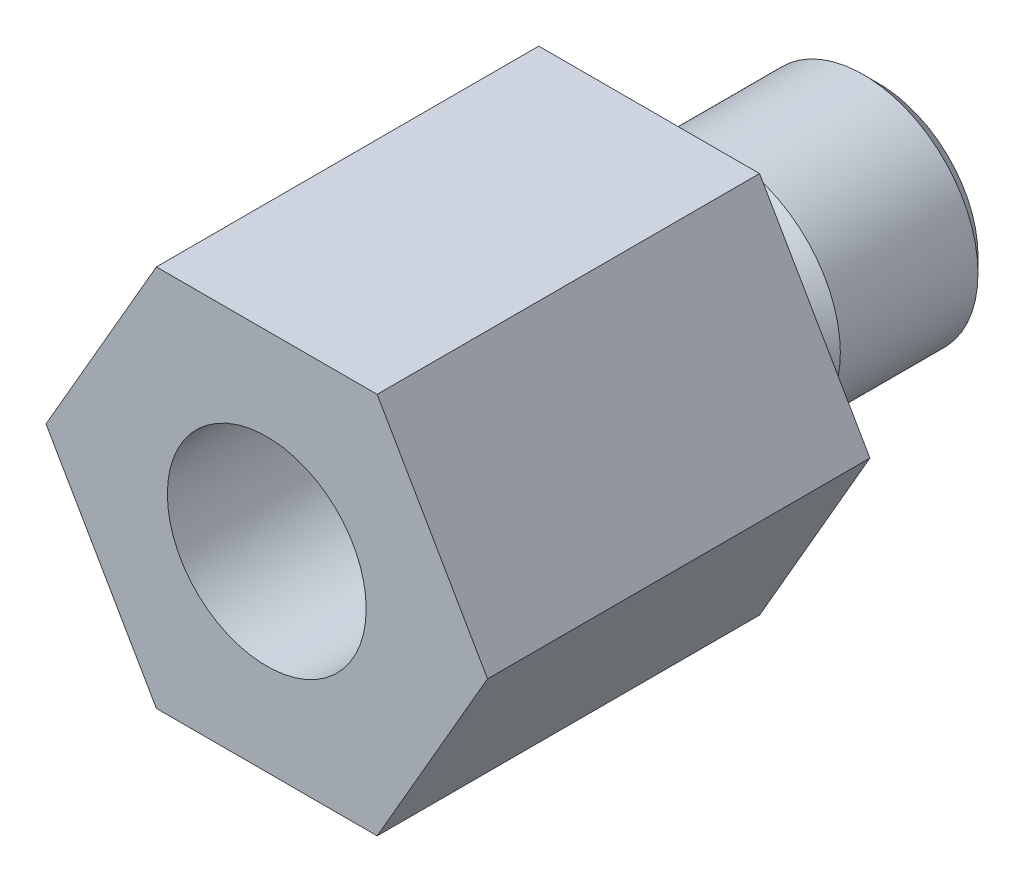
from build123d import *

# Parameters (mm, degrees)
EXTRUSION1_DEPTH        = 5
ESQUISSE2_R             = 1.5
EXTRUSION2_DEPTH        = 3
CHANFREIN1_SIZE         = 0.2
ESQUISSE3_R             = 1.3
ENL_V_MAT_EXTRU_1_DEPTH = 3


with BuildPart() as part:
    # Esquisse1 → Extrusion1 (new body)
    with BuildSketch(Plane.XY):
        Polygon((1.443375673, 2.5), (-1.443375673, 2.5), (-2.886751346, 0), (-1.443375673, -2.5), (1.443375673, -2.5), (2.886751346, 0), align=None)
    extrude(amount=EXTRUSION1_DEPTH)

    # Esquisse2 → Extrusion2 (add)
    with BuildSketch(Plane(origin=(0, 0, 0), x_dir=(-1, 0, 0), z_dir=(0, 0, -1))):
        Circle(ESQUISSE2_R)
    extrude(amount=EXTRUSION2_DEPTH)

    # Chanfrein1
    chanfrein1_edges = [part.edges().sort_by_distance(p)[0] for p in [
        (1.5, 0, -3),
    ]]
    chamfer(chanfrein1_edges, length=CHANFREIN1_SIZE)

    # Esquisse3 → Enlèv. mat.-Extru.1 (cut)
    with BuildSketch(Plane.XY.offset(5)):
        Circle(ESQUISSE3_R)
    extrude(amount=-ENL_V_MAT_EXTRU_1_DEPTH, mode=Mode.SUBTRACT)

    # Esquisse4 → Enlèvement de matière-Révolution1 (revolve, cut)
    with BuildSketch(Plane(origin=(0, 0, 0), x_dir=(1, 0, 0), z_dir=(0, 1, 0)), mode=Mode.PRIVATE) as enl_vement_de_mati_re_r_volution1_sk:
        with BuildLine():
            Line((1.2, 0.617157288), (1.2, 0.2))
            ThreePointArc((1.2, 0.2), (1.258578644, 0.058578644), (1.4, 0))
            Line((1.4, 0), (1.804772915, 0))
            Line((1.804772915, 0), (1.804772915, 1.304772915))
            Line((1.804772915, 1.304772915), (1.258578644, 0.758578644))
            ThreePointArc((1.258578644, 0.758578644), (1.215224093, 0.693693974), (1.2, 0.617157288))
        make_face()
    revolve(enl_vement_de_mati_re_r_volution1_sk.sketch.rotate(Axis((0, 0, -4.374841009), (0, 0, 1)), 180), axis=Axis((0, 0, -4.374841009), (0, 0, 1)), mode=Mode.SUBTRACT)


solid = part.part
